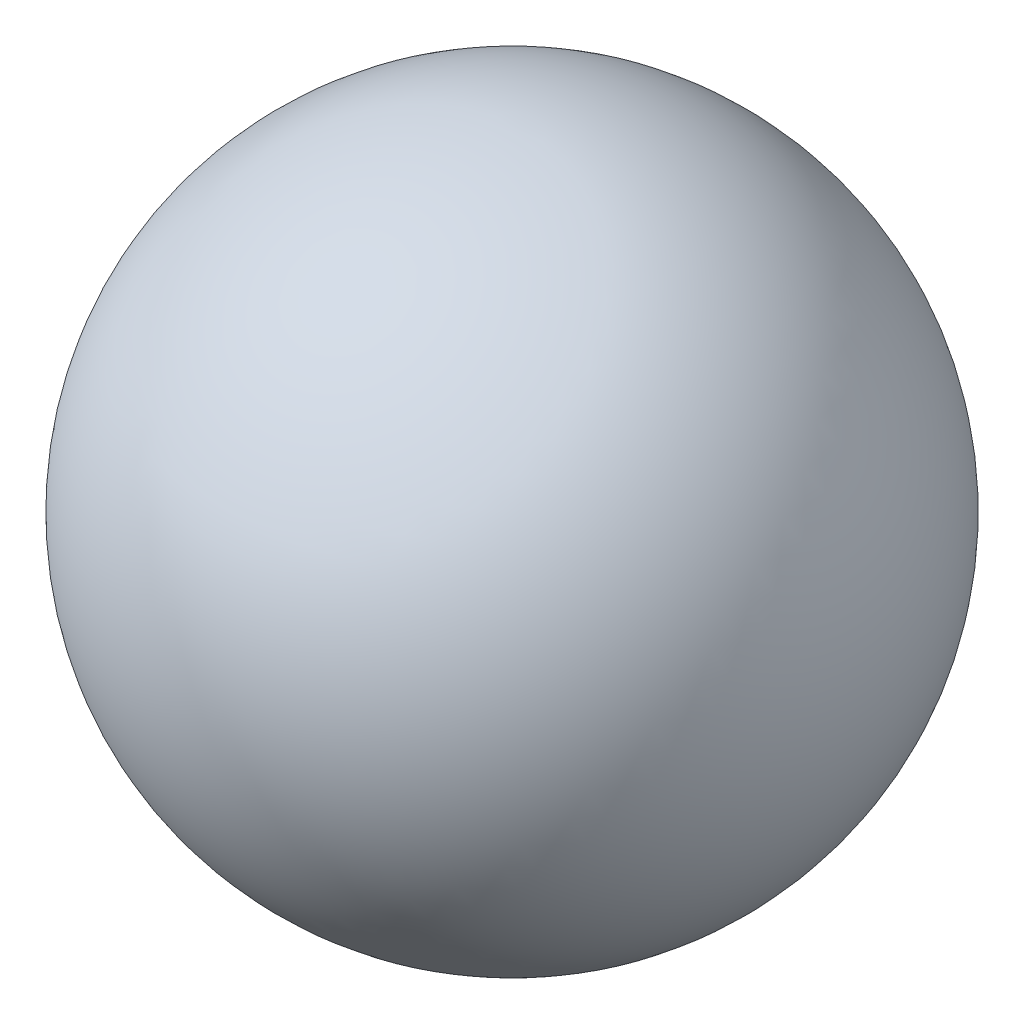
from build123d import *


with BuildPart() as part:
    # Sketch1 → Revolve1 (revolve)
    with BuildSketch(Plane.XY):
        with BuildLine():
            Line((0, -3.5), (0, 3.5))
            ThreePointArc((0, 3.5), (-3.5, 0), (0, -3.5))
        make_face()
    revolve(axis=Axis((0, 3.5, 0), (0, -1, 0)))


solid = part.part
